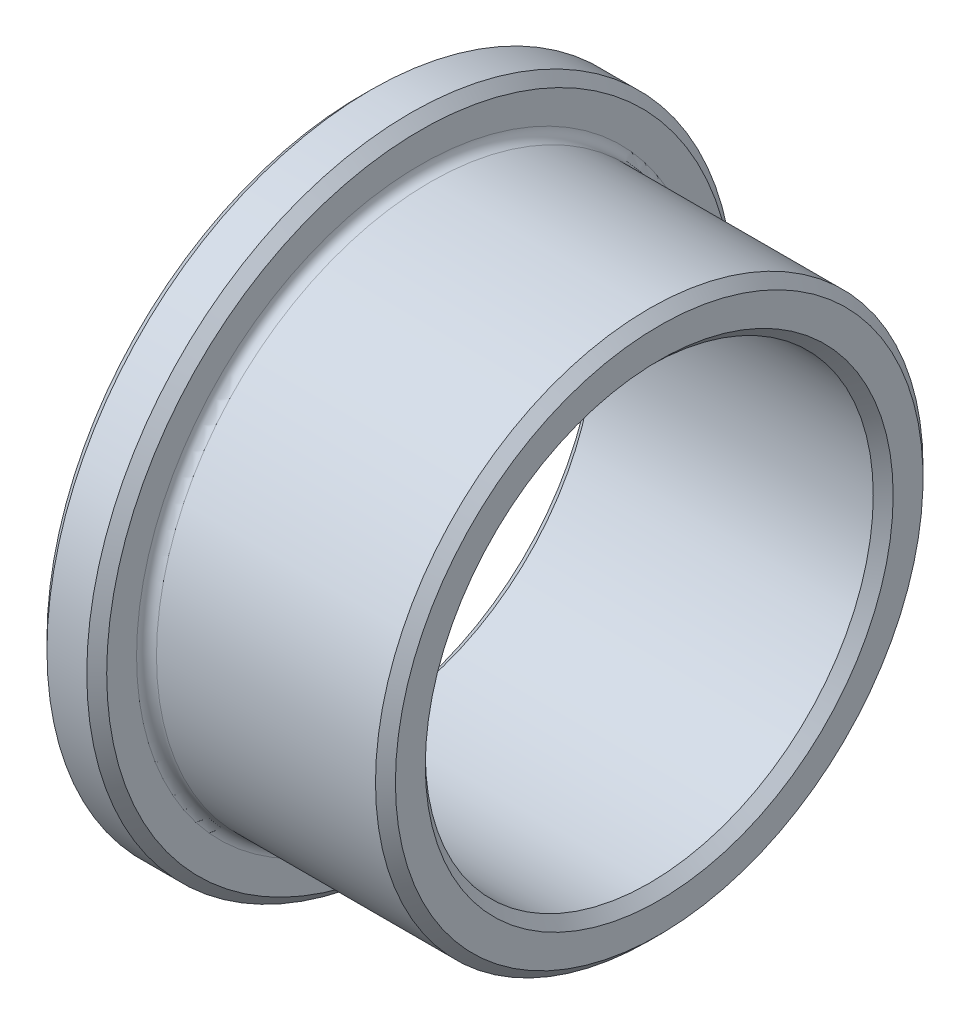
from build123d import *

# Parameters (mm, degrees)
CHAMFER1_SIZE = 1
FILLET1_R     = 1


with BuildPart() as part:
    # Sketch1 → Revolve1 (revolve)
    with BuildSketch(Plane.XY, mode=Mode.PRIVATE) as revolve1_sk:
        Polygon((0, 22.5), (30, 22.5), (30, 27.5), (6, 27.5), (6, 32.5), (0, 32.5), align=None)
    revolve(revolve1_sk.sketch.rotate(Axis((0, 0, 0), (1, 0, 0)), 90), axis=Axis((0, 0, 0), (1, 0, 0)))

    # Chamfer1
    chamfer1_edges = [part.edges().sort_by_distance(p)[0] for p in [
        (0, 0, -32.5),
        (6, 0, -32.5),
        (30, 0, -27.5),
        (30, 0, -22.5),
        (0, 0, -22.5),
    ]]
    chamfer(chamfer1_edges, length=CHAMFER1_SIZE)

    # Fillet1
    fillet1_edges = [part.edges().sort_by_distance(p)[0] for p in [
        (6, 0, -27.5),
    ]]
    fillet(fillet1_edges, radius=FILLET1_R)


solid = part.part
